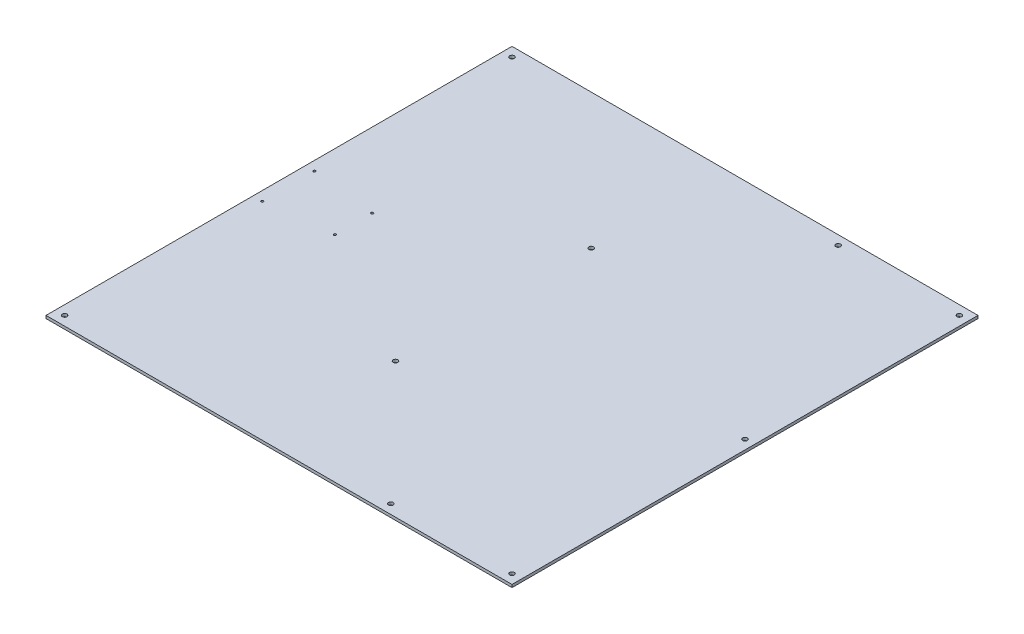
from build123d import *

# Parameters (mm, degrees)
SKETCH1_W           = 500
SKETCH1_H           = 500
BOSS_EXTRUDE1_DEPTH = 3
SKETCH2_R           = 2.5
CUT_EXTRUDE1_DEPTH  = 3
SKETCH3_R           = 1.25
CUT_EXTRUDE2_DEPTH  = 3
SKETCH4_R           = 2.5
CUT_EXTRUDE3_DEPTH  = 3
SKETCH5_R           = 2.5
CUT_EXTRUDE4_DEPTH  = 3


with BuildPart() as part:
    # Sketch1 → Boss-Extrude1 (new body)
    with BuildSketch(Plane(origin=(0, 0, 0), x_dir=(1, 0, 0), z_dir=(0, 1, 0))):
        Rectangle(SKETCH1_W, SKETCH1_H)
    extrude(amount=BOSS_EXTRUDE1_DEPTH)

    # Sketch2 → Cut-Extrude1 (cut)
    with BuildSketch(Plane(origin=(0, 3, 0), x_dir=(1, 0, 0), z_dir=(0, 1, 0))):
        with Locations(Location((-240, 240, 0), (0, 0, 270))):
            Circle(SKETCH2_R)
        with Locations(Location((240, 240, 0), (0, 0, 270))):
            Circle(SKETCH2_R)
        with Locations(Location((240, -240, 0), (0, 0, 270))):
            Circle(SKETCH2_R)
        with Locations(Location((-240, -240, 0), (0, 0, 270))):
            Circle(SKETCH2_R)
    extrude(amount=-CUT_EXTRUDE1_DEPTH, mode=Mode.SUBTRACT)

    # Sketch3 → Cut-Extrude2 (cut)
    with BuildSketch(Plane(origin=(0, 3, 0), x_dir=(1, 0, 0), z_dir=(0, 1, 0))):
        with Locations(Location((-240, 28, 0), (0, 0, 270))):
            Circle(SKETCH3_R)
        with Locations(Location((-170, 20, 0), (0, 0, 270))):
            Circle(SKETCH3_R)
        with Locations(Location((-170, -20, 0), (0, 0, 270))):
            Circle(SKETCH3_R)
        with Locations(Location((-240, -28, 0), (0, 0, 270))):
            Circle(SKETCH3_R)
    extrude(amount=-CUT_EXTRUDE2_DEPTH, mode=Mode.SUBTRACT)

    # Sketch4 → Cut-Extrude3 (cut)
    with BuildSketch(Plane(origin=(0, 3, 0), x_dir=(1, 0, 0), z_dir=(0, 1, 0))):
        with Locations(Location((240, 10, 0), (0, 0, 270))):
            Circle(SKETCH4_R)
        with Locations(Location((110, 240, 0), (0, 0, 270))):
            Circle(SKETCH4_R)
        with Locations(Location((110, -240, 0), (0, 0, 270))):
            Circle(SKETCH4_R)
    extrude(amount=-CUT_EXTRUDE3_DEPTH, mode=Mode.SUBTRACT)

    # Sketch5 → Cut-Extrude4 (cut)
    with BuildSketch(Plane(origin=(0, 3, 0), x_dir=(1, 0, 0), z_dir=(0, 1, 0))):
        with Locations(Location((-20, 105, 0), (0, 0, 270))):
            Circle(SKETCH5_R)
        with Locations(Location((-20, -105, 0), (0, 0, 270))):
            Circle(SKETCH5_R)
    extrude(amount=-CUT_EXTRUDE4_DEPTH, mode=Mode.SUBTRACT)


solid = part.part
